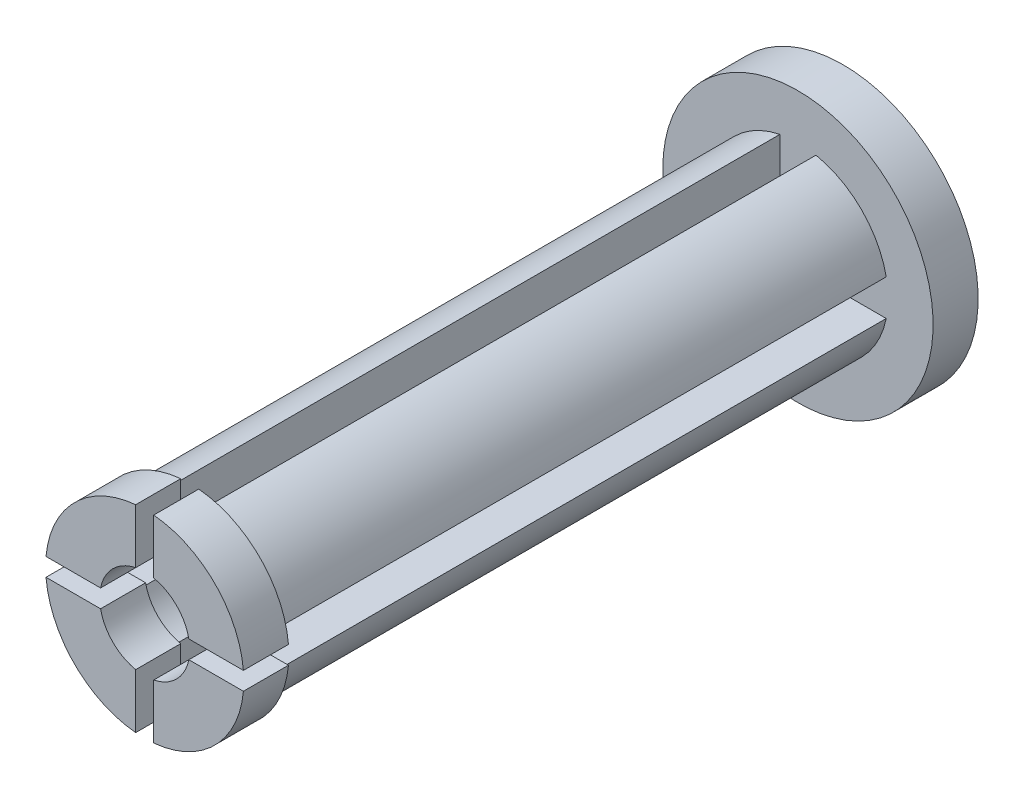
from build123d import *

# Parameters (mm, degrees)
SKETCH1_R           = 2
BOSS_EXTRUDE1_DEPTH = 13.5
SKETCH2_R           = 1.2
CUT_EXTRUDE1_DEPTH  = 14.793114224
SKETCH3_W           = 0.8
SKETCH3_H           = 6.59267807
SKETCH3_W_2         = 7.006923124
SKETCH3_H_2         = 0.8
CUT_EXTRUDE3_DEPTH  = 14.793114224
BOSS_EXTRUDE2_DEPTH = 1
SKETCH5_R           = 3
BOSS_EXTRUDE3_DEPTH = 1


with BuildPart() as part:
    # Sketch1 → Boss-Extrude1 (new body)
    with BuildSketch(Plane.XY):
        Circle(SKETCH1_R)
    extrude(amount=BOSS_EXTRUDE1_DEPTH)

    # Sketch2 → Cut-Extrude1 (cut, through all)
    with BuildSketch(Plane.XY.offset(13.5)):
        Circle(SKETCH2_R)
    extrude(amount=-CUT_EXTRUDE1_DEPTH, mode=Mode.SUBTRACT)

    # Sketch3 → Cut-Extrude3 (cut, through all)
    with BuildSketch(Plane.XY.offset(13.5)):
        Rectangle(SKETCH3_W, SKETCH3_H)
        Rectangle(SKETCH3_W_2, SKETCH3_H_2)
    extrude(amount=-CUT_EXTRUDE3_DEPTH, mode=Mode.SUBTRACT)


with BuildPart() as cut_extrude3_piece_1:
    # of the separate pieces the step leaves, piece 1, a body of its own (cut_extrude3_pieces)
    add(part.part.solids().sort_by_distance((1.959591794, 0.4, 0))[0])



with BuildPart() as cut_extrude3_piece_2:
    # of the separate pieces the step leaves, piece 2, a body of its own (cut_extrude3_pieces)
    add(part.part.solids().sort_by_distance((0.4, -1.959591794, 0))[0])


with BuildPart() as cut_extrude3_piece_3:
    # of the separate pieces the step leaves, piece 3, a body of its own (cut_extrude3_pieces)
    add(part.part.solids().sort_by_distance((-1.959591794, -0.4, 0))[0])


with BuildPart() as cut_extrude3_piece_4:
    # of the separate pieces the step leaves, piece 4, a body of its own (cut_extrude3_pieces)
    add(part.part.solids().sort_by_distance((-0.4, 1.959591794, 0))[0])


with BuildPart() as cut_extrude3_piece_1_1:
    add(cut_extrude3_piece_1.part)

    add(cut_extrude3_piece_2.part)  # Boss-Extrude2 merges Cut-Extrude3 piece 2

    add(cut_extrude3_piece_3.part)  # Boss-Extrude2 merges Cut-Extrude3 piece 3

    add(cut_extrude3_piece_4.part)  # Boss-Extrude2 merges Cut-Extrude3 piece 4
    # Sketch4 → Boss-Extrude2 (add)
    with BuildSketch(Plane.XY.offset(13.5)):
        with BuildLine():
            Line((-2.19089023, 0.2), (-0.979795897, 0.2))
            ThreePointArc((-0.979795897, 0.2), (-0.707106781, 0.707106781), (-0.2, 0.979795897))
            Line((-0.2, 0.979795897), (-0.2, 2.19089023))
            ThreePointArc((-0.2, 2.19089023), (-1.555634919, 1.555634919), (-2.19089023, 0.2))
        make_face()
        with BuildLine():
            Line((0.979795897, 0.2), (2.19089023, 0.2))
            ThreePointArc((2.19089023, 0.2), (1.555634919, 1.555634919), (0.2, 2.19089023))
            Line((0.2, 2.19089023), (0.2, 0.979795897))
            ThreePointArc((0.2, 0.979795897), (0.707106781, 0.707106781), (0.979795897, 0.2))
        make_face()
        with BuildLine():
            Line((0.2, -0.979795897), (0.2, -2.19089023))
            ThreePointArc((0.2, -2.19089023), (1.555634919, -1.555634919), (2.19089023, -0.2))
            Line((2.19089023, -0.2), (0.979795897, -0.2))
            ThreePointArc((0.979795897, -0.2), (0.707106781, -0.707106781), (0.2, -0.979795897))
        make_face()
        with BuildLine():
            Line((-0.979795897, -0.2), (-2.19089023, -0.2))
            ThreePointArc((-2.19089023, -0.2), (-1.555634919, -1.555634919), (-0.2, -2.19089023))
            Line((-0.2, -2.19089023), (-0.2, -0.979795897))
            ThreePointArc((-0.2, -0.979795897), (-0.707106781, -0.707106781), (-0.979795897, -0.2))
        make_face()
    extrude(amount=BOSS_EXTRUDE2_DEPTH)

    # Sketch5 → Boss-Extrude3 (add)
    with BuildSketch(Plane(origin=(0, 0, 0), x_dir=(-1, 0, 0), z_dir=(0, 0, -1))):
        Circle(SKETCH5_R)
    extrude(amount=BOSS_EXTRUDE3_DEPTH)


solid = cut_extrude3_piece_1_1.part
